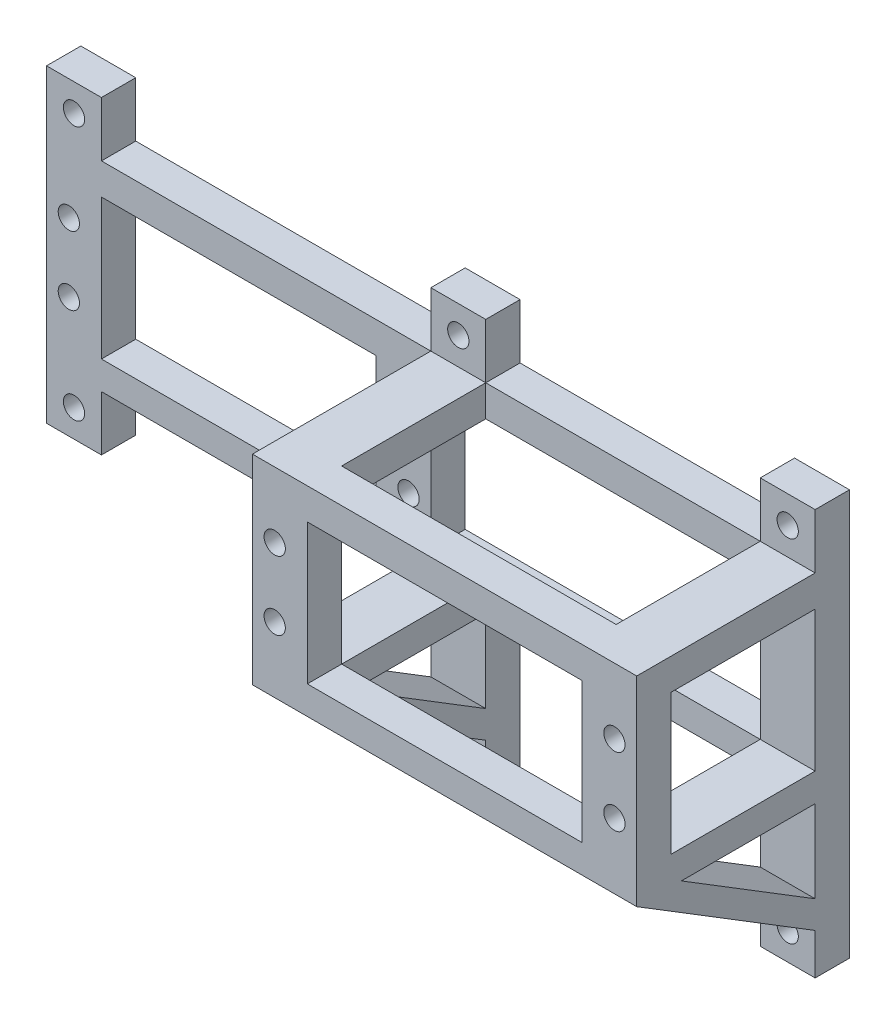
from build123d import *

# Parameters (mm, degrees)
SKETCH1_W            = 112
SKETCH1_H            = 4.112760254
BOSS_EXTRUDE1_DEPTH  = 5
SKETCH2_W            = 8
SKETCH2_H            = 5
BOSS_EXTRUDE2_DEPTH  = 25
SKETCH3_W            = 5
SKETCH3_H            = 4.556380127
BOSS_EXTRUDE3_DEPTH  = 45
SKETCH4_W            = 5
SKETCH4_H            = 4.556380127
BOSS_EXTRUDE5_DEPTH  = 51
SKETCH6_W            = 8
SKETCH6_H            = 4.112760254
SKETCH6_H_2          = 4.556380127
BOSS_EXTRUDE6_DEPTH  = 26
SKETCH7_W            = 8
SKETCH7_H            = 5
BOSS_EXTRUDE7_DEPTH  = 21
SKETCH8_W            = 8
SKETCH8_H            = 5
BOSS_EXTRUDE8_DEPTH  = 21
SKETCH9_W            = 5
SKETCH9_H            = 4.556380127
SKETCH9_H_2          = 4.112760254
BOSS_EXTRUDE9_DEPTH  = 51
SKETCH10_R           = 1.55
CUT_EXTRUDE1_DEPTH   = 10
SKETCH12_R           = 1.55
CUT_EXTRUDE2_DEPTH   = 10
SKETCH13_W           = 8
SKETCH13_H           = 5
BOSS_EXTRUDE10_DEPTH = 8
SKETCH14_W           = 8
SKETCH14_H           = 5
BOSS_EXTRUDE11_DEPTH = 8
SKETCH15_W           = 8
SKETCH15_H           = 5
BOSS_EXTRUDE12_DEPTH = 22
BOSS_EXTRUDE13_DEPTH = 8
BOSS_EXTRUDE14_DEPTH = 8
SKETCH18_R           = 1.55
CUT_EXTRUDE3_DEPTH   = 8
SKETCH19_R           = 1.55
CUT_EXTRUDE4_DEPTH   = 8
SKETCH20_R           = 1.55
CUT_EXTRUDE5_DEPTH   = 8
SKETCH21_R           = 1.55
CUT_EXTRUDE6_DEPTH   = 8
SKETCH22_R           = 1.55
CUT_EXTRUDE7_DEPTH   = 8
SKETCH23_R           = 1.55
CUT_EXTRUDE8_DEPTH   = 8


with BuildPart() as part:
    # Sketch1 → Boss-Extrude1 (new body)
    with BuildSketch(Plane.XY):
        with Locations((16.256437691, 0)):
            Rectangle(SKETCH1_W, SKETCH1_H)
    extrude(amount=-BOSS_EXTRUDE1_DEPTH)

    # Sketch2 → Boss-Extrude2 (add)
    with BuildSketch(Plane(origin=(0, 2.056380127, 0), x_dir=(1, 0, 0), z_dir=(0, 1, 0))):
        with Locations((-35.743562309, 2.5)):
            Rectangle(SKETCH2_W, SKETCH2_H)
        with Locations((12.256437691, 2.5)):
            Rectangle(SKETCH2_W, SKETCH2_H)
        with Locations((68.256437691, 2.5)):
            Rectangle(SKETCH2_W, SKETCH2_H)
    extrude(amount=BOSS_EXTRUDE2_DEPTH)

    # Sketch3 → Boss-Extrude3 (add)
    with BuildSketch(Plane(origin=(-31.743562309, 0, 0), x_dir=(0, 0, -1), z_dir=(1, 0, 0))):
        with Locations((2.5, 24.778190063)):
            Rectangle(SKETCH3_W, SKETCH3_H)
    extrude(amount=BOSS_EXTRUDE3_DEPTH)

    # Sketch4 → Boss-Extrude5 (add)
    with BuildSketch(Plane.ZY.offset(-64.256437691)):
        with Locations((-2.5, 24.778190063)):
            Rectangle(SKETCH4_W, SKETCH4_H)
    extrude(amount=BOSS_EXTRUDE5_DEPTH)

    # Sketch6 → Boss-Extrude6 (add)
    with BuildSketch(Plane.XY):
        with Locations((20.256437691, 0)):
            Rectangle(SKETCH6_W, SKETCH6_H)
        with Locations((20.256437691, 24.778190063)):
            Rectangle(SKETCH6_W, SKETCH6_H_2)
        with Locations((68.256437691, 24.778190063)):
            Rectangle(SKETCH6_W, SKETCH6_H_2)
        with Locations((68.256437691, 0)):
            Rectangle(SKETCH6_W, SKETCH6_H)
    extrude(amount=BOSS_EXTRUDE6_DEPTH)

    # Sketch7 → Boss-Extrude7 (add)
    with BuildSketch(Plane(origin=(0, 2.056380127, 0), x_dir=(1, 0, 0), z_dir=(0, 1, 0))):
        with Locations((20.256437691, -23.5)):
            Rectangle(SKETCH7_W, SKETCH7_H)
    extrude(amount=BOSS_EXTRUDE7_DEPTH)

    # Sketch8 → Boss-Extrude8 (add)
    with BuildSketch(Plane(origin=(0, 2.056380127, 0), x_dir=(1, 0, 0), z_dir=(0, 1, 0))):
        with Locations((68.256437691, -23.5)):
            Rectangle(SKETCH8_W, SKETCH8_H)
    extrude(amount=BOSS_EXTRUDE8_DEPTH)

    # Sketch9 → Boss-Extrude9 (add)
    with BuildSketch(Plane(origin=(16.256437691, 0, 0), x_dir=(0, 0, -1), z_dir=(1, 0, 0))):
        with Locations((-23.5, 24.778190063)):
            Rectangle(SKETCH9_W, SKETCH9_H)
        with Locations((-23.5, 0)):
            Rectangle(SKETCH9_W, SKETCH9_H_2)
    extrude(amount=BOSS_EXTRUDE9_DEPTH)

    # Sketch10 → Cut-Extrude1 (cut)
    with BuildSketch(Plane.XY):
        with Locations((-36.493562309, 17.5)):
            Circle(SKETCH10_R)
        with Locations((-36.493562309, 7.499999266)):
            Circle(SKETCH10_R)
        with Locations((13.006437691, 17.5)):
            Circle(SKETCH10_R)
        with Locations((13.006437691, 7.499999266)):
            Circle(SKETCH10_R)
    extrude(amount=-CUT_EXTRUDE1_DEPTH, mode=Mode.SUBTRACT)

    # Sketch12 → Cut-Extrude2 (cut)
    with BuildSketch(Plane.XY.offset(26)):
        with Locations((19.506437691, 17.5)):
            Circle(SKETCH12_R)
        with Locations((19.505003197, 7.500000103)):
            Circle(SKETCH12_R)
        with Locations((69.006437691, 17.5)):
            Circle(SKETCH12_R)
        with Locations((69.006437691, 7.5)):
            Circle(SKETCH12_R)
    extrude(amount=-CUT_EXTRUDE2_DEPTH, mode=Mode.SUBTRACT)

    # Sketch13 → Boss-Extrude10 (add)
    with BuildSketch(Plane(origin=(0, 27.056380127, 0), x_dir=(1, 0, 0), z_dir=(0, 1, 0))):
        with Locations((-35.743562309, 2.5)):
            Rectangle(SKETCH13_W, SKETCH13_H)
        with Locations((20.256437691, 2.5)):
            Rectangle(SKETCH13_W, SKETCH13_H)
        with Locations((68.256437691, 2.5)):
            Rectangle(SKETCH13_W, SKETCH13_H)
    extrude(amount=BOSS_EXTRUDE10_DEPTH)

    # Sketch14 → Boss-Extrude11 (add)
    with BuildSketch(Plane.XZ.offset(2.056380127)):
        with Locations((-35.743562309, -2.5)):
            Rectangle(SKETCH14_W, SKETCH14_H)
    extrude(amount=BOSS_EXTRUDE11_DEPTH)

    # Sketch15 → Boss-Extrude12 (add)
    with BuildSketch(Plane.XZ.offset(2.056380127)):
        with Locations((20.256437691, -2.5)):
            Rectangle(SKETCH15_W, SKETCH15_H)
        with Locations((68.256437691, -2.5)):
            Rectangle(SKETCH15_W, SKETCH15_H)
    extrude(amount=BOSS_EXTRUDE12_DEPTH)

    # Sketch16 → Boss-Extrude13 (add)
    with BuildSketch(Plane.ZY.offset(-16.256437691)):
        Polygon((0, -18.056380127), (0, -14.056380127), (26, 1.943619873), (26, -2.056380127), align=None)
    extrude(amount=-BOSS_EXTRUDE13_DEPTH)

    # Sketch17 → Boss-Extrude14 (add)
    with BuildSketch(Plane(origin=(72.256437691, 0, 0), x_dir=(0, 0, -1), z_dir=(1, 0, 0))):
        Polygon((0, -18.056380127), (0, -14.056380127), (-26, 1.943619873), (-26, -2.056380127), align=None)
    extrude(amount=-BOSS_EXTRUDE14_DEPTH)

    # Sketch18 → Cut-Extrude3 (cut)
    with BuildSketch(Plane.XY):
        with Locations((-35.743562309, 31.056380127)):
            Circle(SKETCH18_R)
    extrude(amount=-CUT_EXTRUDE3_DEPTH, mode=Mode.SUBTRACT)

    # Sketch19 → Cut-Extrude4 (cut)
    with BuildSketch(Plane.XY):
        with Locations((20.256437691, 31.056380127)):
            Circle(SKETCH19_R)
    extrude(amount=-CUT_EXTRUDE4_DEPTH, mode=Mode.SUBTRACT)

    # Sketch20 → Cut-Extrude5 (cut)
    with BuildSketch(Plane.XY):
        with Locations((68.256437691, 31.056380127)):
            Circle(SKETCH20_R)
    extrude(amount=-CUT_EXTRUDE5_DEPTH, mode=Mode.SUBTRACT)

    # Sketch21 → Cut-Extrude6 (cut)
    with BuildSketch(Plane.XY):
        with Locations((-35.743562309, -6.056380127)):
            Circle(SKETCH21_R)
    extrude(amount=-CUT_EXTRUDE6_DEPTH, mode=Mode.SUBTRACT)

    # Sketch22 → Cut-Extrude7 (cut)
    with BuildSketch(Plane.XY):
        with Locations((20.256437691, -20.056380127)):
            Circle(SKETCH22_R)
    extrude(amount=-CUT_EXTRUDE7_DEPTH, mode=Mode.SUBTRACT)

    # Sketch23 → Cut-Extrude8 (cut)
    with BuildSketch(Plane.XY):
        with Locations((68.256437691, -20.056380127)):
            Circle(SKETCH23_R)
    extrude(amount=-CUT_EXTRUDE8_DEPTH, mode=Mode.SUBTRACT)


solid = part.part
